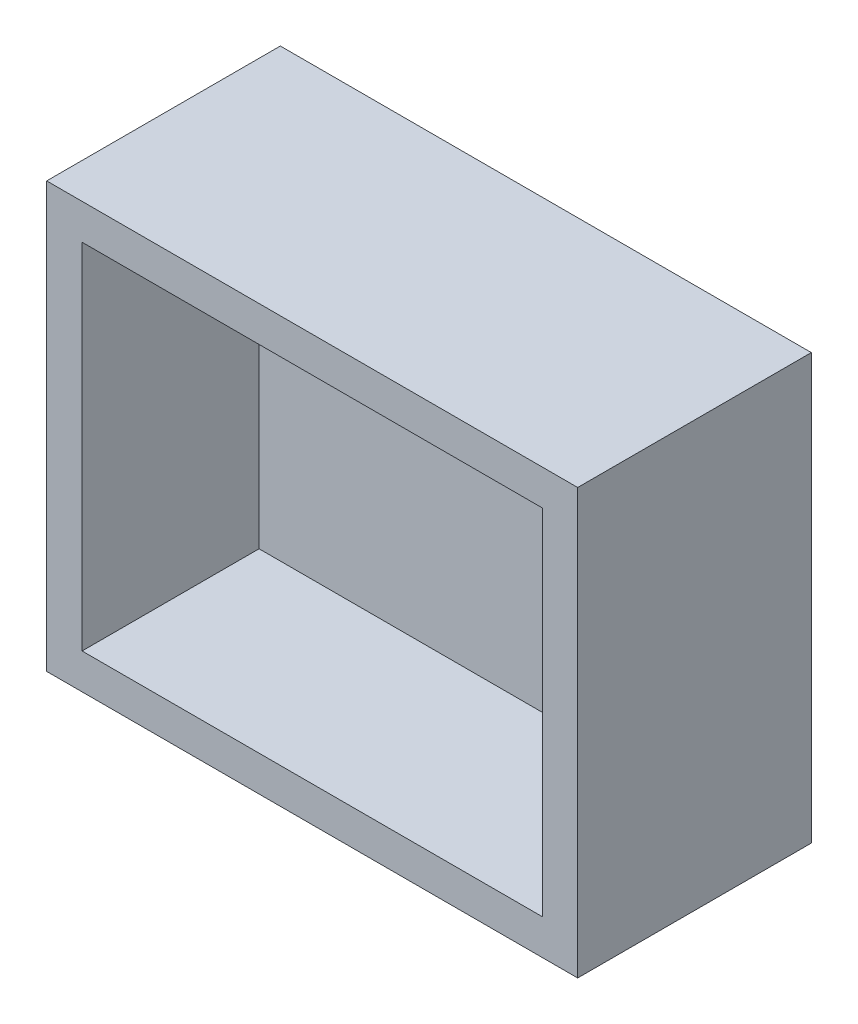
from build123d import *

# Parameters (mm, degrees)
ESQUISSE1_W             = 75
ESQUISSE1_H             = 60
BOSS_EXTRU_1_DEPTH      = 8
ESQUISSE2_W             = 40
ESQUISSE2_H             = 20
ENL_V_MAT_EXTRU_1_DEPTH = 8
ESQUISSE3_W             = 8.5
ESQUISSE3_H             = 2.5
ENL_V_MAT_EXTRU_2_DEPTH = 8
ESQUISSE4_R             = 2.7
ENL_V_MAT_EXTRU_3_DEPTH = 49.685213361
ESQUISSE6_W             = 75
ESQUISSE6_H             = 60
BOSS_EXTRU_2_DEPTH      = 35
ESQUISSE7_W             = 65
ESQUISSE7_H             = 50
ENL_V_MAT_EXTRU_4_DEPTH = 35
CUT_EXTRUDE1_REACH      = 90.034
SKETCH1_W               = 10
SKETCH1_H               = 60


with BuildPart() as part:
    # Esquisse1 → Boss.-Extru.1 (new body)
    with BuildSketch(Plane.XY):
        Rectangle(ESQUISSE1_W, ESQUISSE1_H)
    extrude(amount=-BOSS_EXTRU_1_DEPTH)

    # Esquisse2 → Enlèv. mat.-Extru.1 (cut)
    with BuildSketch(Plane.XY):
        with Locations((0, 12.5)):
            Rectangle(ESQUISSE2_W, ESQUISSE2_H)
    extrude(amount=-ENL_V_MAT_EXTRU_1_DEPTH, mode=Mode.SUBTRACT)

    # Esquisse3 → Enlèv. mat.-Extru.2 (cut)
    with BuildSketch(Plane.XY):
        with Locations((-24.25, 12.5)):
            Rectangle(ESQUISSE3_W, ESQUISSE3_H)
    enl_v_mat_extru_2 = extrude(amount=-ENL_V_MAT_EXTRU_2_DEPTH, mode=Mode.SUBTRACT)

    # Esquisse4 → Enlèv. mat.-Extru.3 (cut, through all)
    with BuildSketch(Plane.XY):
        with Locations((-24, 17.5)):
            Circle(ESQUISSE4_R)
        with Locations((-24, 7.5)):
            Circle(ESQUISSE4_R)
    enl_v_mat_extru_3 = extrude(amount=-ENL_V_MAT_EXTRU_3_DEPTH, mode=Mode.SUBTRACT)

    # Symétrie2: Enlèv. mat.-Extru.2, Enlèv. mat.-Extru.3 across plane
    add(enl_v_mat_extru_2.mirror(Plane(origin=(0, 0, 0), x_dir=(0, 0, 1), z_dir=(1, 0, 0))), mode=Mode.SUBTRACT)
    add(enl_v_mat_extru_3.mirror(Plane(origin=(0, 0, 0), x_dir=(0, 0, 1), z_dir=(1, 0, 0))), mode=Mode.SUBTRACT)

    # Esquisse6 → Boss.-Extru.2 (add)
    with BuildSketch(Plane.XY):
        Rectangle(ESQUISSE6_W, ESQUISSE6_H)
    extrude(amount=BOSS_EXTRU_2_DEPTH)

    # Esquisse7 → Enlèv. mat.-Extru.4 (cut)
    with BuildSketch(Plane.XY.offset(35)):
        Rectangle(ESQUISSE7_W, ESQUISSE7_H)
    extrude(amount=-ENL_V_MAT_EXTRU_4_DEPTH, mode=Mode.SUBTRACT)

    # Cut-Extrude1: up to this face of the body (flat: up to its plane)
    cut_extrude1_end = Plane(part.part.faces().sort_by_distance((-37.5, 0, 13.5))[0])
    # Sketch1 → Cut-Extrude1 (cut, up to the picked face)
    with BuildSketch(Plane(origin=(37.5, 0, 0), x_dir=(0, 0, -1), z_dir=(1, 0, 0)), mode=Mode.PRIVATE) as cut_extrude1_sk1:
        with Locations((-30, 0)):
            Rectangle(SKETCH1_W, SKETCH1_H)
    cut_extrude1_tool1 = split(extrude(cut_extrude1_sk1.sketch, amount=-CUT_EXTRUDE1_REACH, mode=Mode.PRIVATE), bisect_by=cut_extrude1_end, keep=Keep.BOTH, mode=Mode.PRIVATE)
    add(cut_extrude1_tool1.solids().sort_by(Axis((37.5, 0, 30), (-1, 0, 0)))[0], mode=Mode.SUBTRACT)


solid = part.part
